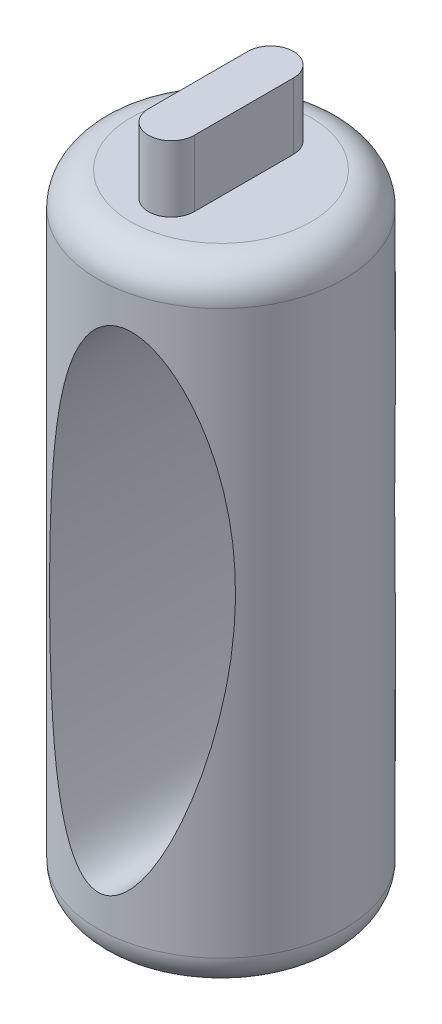
from build123d import *

# Parameters (mm, degrees)
SKETCH_1_R               = 7.45
EXTRUDE_1_DEPTH          = 38
FILLET_1_R               = 2
CUT_EXTRUDE_1_DEPTH      = 40.433551723
CUT_EXTRUDE_1_DEPTH_BACK = 40.433551723
SKETCH_2_RX              = 15.093010042
SKETCH_2_RY              = 4.896660512
EXTRUDE_1_2_DEPTH        = 4


with BuildPart() as part:
    # Эскиз1 → Extrude 1 (new body)
    with BuildSketch(Plane(origin=(0, 0, 0), x_dir=(1, 0, 0), z_dir=(0, 1, 0))):
        with Locations(Location((0, 0, 0), (0, 0, 270))):
            Circle(SKETCH_1_R)
    extrude(amount=EXTRUDE_1_DEPTH)

    # Скругление1
    fillet_1_edges = [part.edges().sort_by_distance(p)[0] for p in [
        (0, 0, -7.45),
        (0, 38, -7.45),
    ]]
    fillet(fillet_1_edges, radius=FILLET_1_R)

    # Эскиз2 → Вырез-Вытянуть1 (cut, two sides: drawn at the far end of the back side and taken through both)
    with BuildSketch(Plane.XY.offset(-CUT_EXTRUDE_1_DEPTH_BACK)):
        with Locations(Location((0.737430759, 19), (0, 0, -92.943333717))):
            Ellipse(SKETCH_2_RX, SKETCH_2_RY)
    extrude(amount=CUT_EXTRUDE_1_DEPTH + CUT_EXTRUDE_1_DEPTH_BACK, mode=Mode.SUBTRACT)


with BuildPart() as body_2:
    # Эскиз3 → Extrude 1 2 (new body)
    with BuildSketch(Plane(origin=(0, 38, 0), x_dir=(1, 0, 0), z_dir=(0, 1, 0))):
        with BuildLine():
            Line((1.385702183, 3), (1.385702183, -3))
            ThreePointArc((1.385702183, -3), (0, -4.385702183), (-1.385702183, -3))
            Line((-1.385702183, -3), (-1.385702183, 3))
            ThreePointArc((-1.385702183, 3), (0, 4.385702183), (1.385702183, 3))
        make_face()
    extrude(amount=EXTRUDE_1_2_DEPTH)


solid = Compound([part.part, body_2.part])
